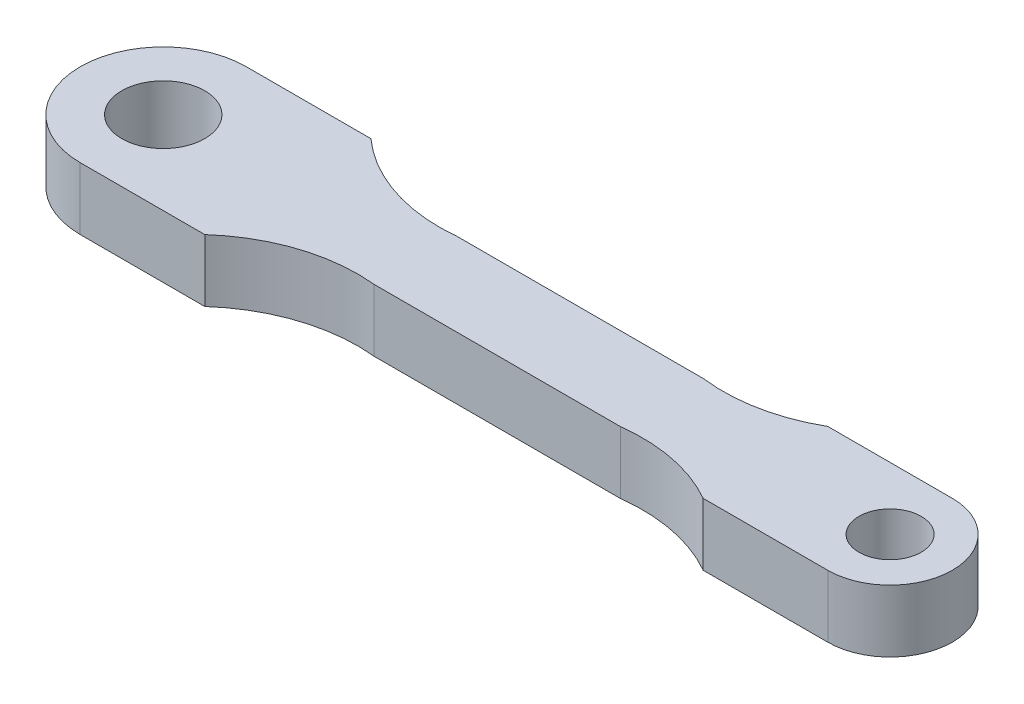
from build123d import *

# Parameters (mm, degrees)
SKETCH1_R           = 4
SKETCH1_R_2         = 2
SKETCH1_R_3         = 3
SKETCH1_R_4         = 1.5
BOSS_EXTRUDE1_DEPTH = 1.5


with BuildPart() as part:
    # Sketch1 → Boss-Extrude1 (new, symmetric)
    # profile 1 of 3: a face of its own
    with BuildSketch(Plane(origin=(0, 0, 0), x_dir=(1, 0, 0), z_dir=(0, 1, 0))):
        with BuildLine():
            Line((-11.5, 4), (-17.5, 4))
            ThreePointArc((-17.5, 4), (-14.671572875, 2.828427125), (-13.5, 0))
            ThreePointArc((-13.5, 0), (-14.671572875, -2.828427125), (-17.5, -4))
            Line((-17.5, -4), (-11.5, -4))
            ThreePointArc((-11.5, -4), (-8.632069519, -2.34904785), (-5.341350168, -2))
            Line((-5.341350168, -2), (6.516979908, -2))
            ThreePointArc((6.516979908, -2), (9.090013088, -2.093768583), (11.5, -3))
            Line((11.5, -3), (17.5, -3))
            ThreePointArc((17.5, -3), (14.5, 0), (17.5, 3))
            Line((17.5, 3), (11.5, 3))
            ThreePointArc((11.5, 3), (9.090013088, 2.093768583), (6.516979908, 2))
            Line((6.516979908, 2), (-5.341350168, 2))
            ThreePointArc((-5.341350168, 2), (-8.632069519, 2.34904785), (-11.5, 4))
        make_face()
    # profile 2 of 3: a face of its own
    with BuildSketch(Plane(origin=(0, 0, 0), x_dir=(1, 0, 0), z_dir=(0, 1, 0))):
        with Locations((-17.5, 0)):
            Circle(SKETCH1_R)
        with Locations(Location((-17.5, 0, 0), (0, 0, 270))):
            Circle(SKETCH1_R_2, mode=Mode.SUBTRACT)
    # profile 3 of 3: a face of its own
    with BuildSketch(Plane(origin=(0, 0, 0), x_dir=(1, 0, 0), z_dir=(0, 1, 0))):
        with Locations((17.5, 0)):
            Circle(SKETCH1_R_3)
        with Locations(Location((17.5, 0, 0), (0, 0, 270))):
            Circle(SKETCH1_R_4, mode=Mode.SUBTRACT)
    extrude(amount=BOSS_EXTRUDE1_DEPTH, both=True)


solid = part.part
